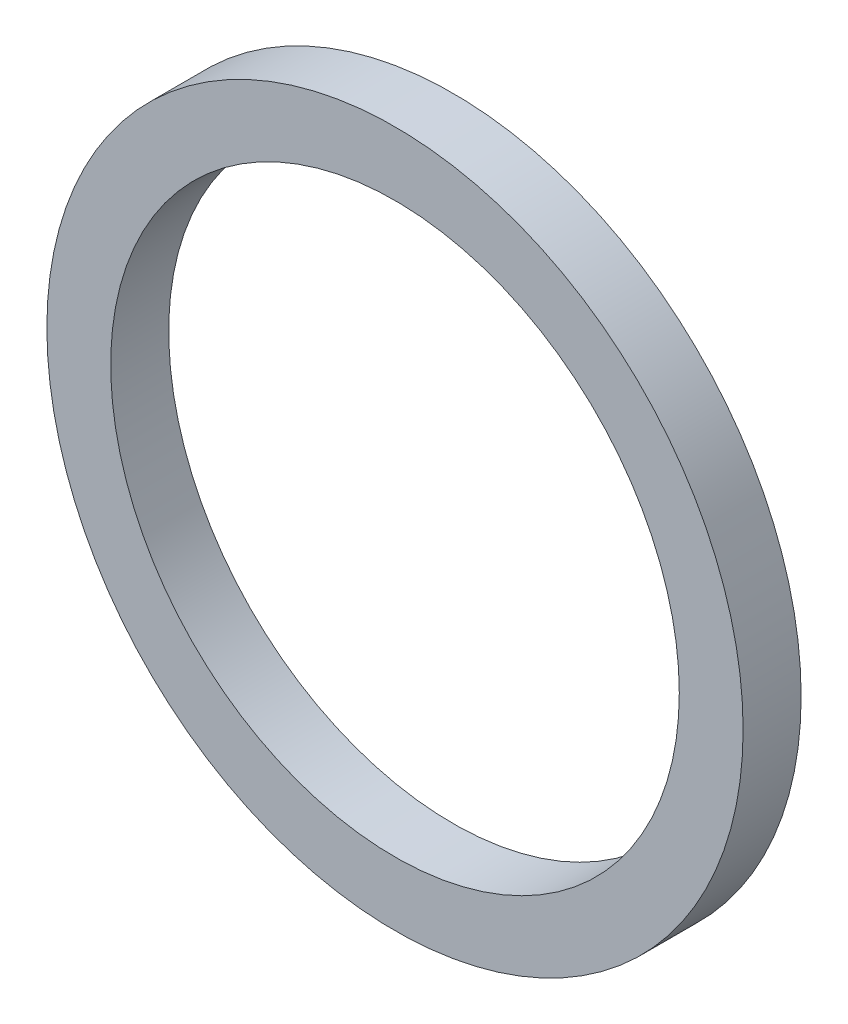
from build123d import *

# Parameters (mm, degrees)
SKETCH1_R           = 19.05
SKETCH1_R_2         = 15.5575
BOSS_EXTRUDE1_DEPTH = 1.5875


with BuildPart() as part:
    # Sketch1 → Boss-Extrude1 (new, symmetric)
    with BuildSketch(Plane.XY):
        Circle(SKETCH1_R)
        Circle(SKETCH1_R_2, mode=Mode.SUBTRACT)
    extrude(amount=BOSS_EXTRUDE1_DEPTH, both=True)


solid = part.part
